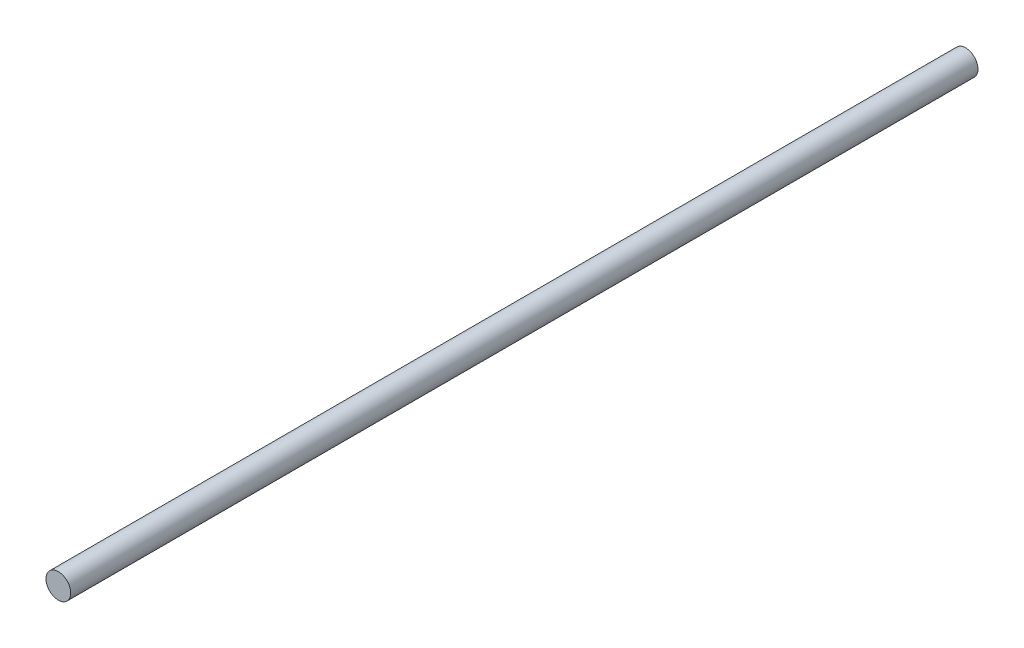
from build123d import *

# Parameters (mm, degrees)
SKETCH_1_R      = 3
EXTRUDE_1_DEPTH = 220


with BuildPart() as part:
    # 草图1 → 凸台-拉伸1 (new body)
    with BuildSketch(Plane.XY):
        Circle(SKETCH_1_R)
    extrude(amount=EXTRUDE_1_DEPTH)


solid = part.part
